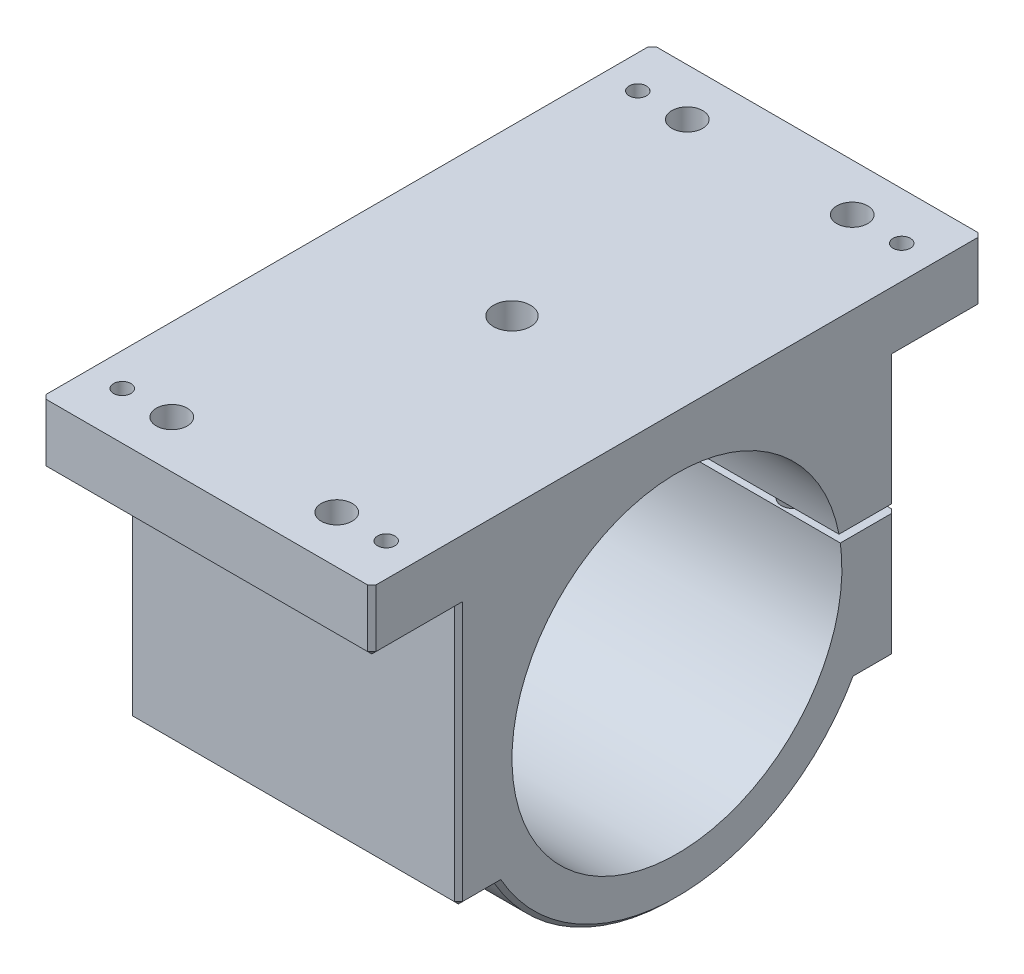
from build123d import *

# Parameters (mm, degrees)
SKETCH1_R           = 40
BOSS_EXTRUDE1_DEPTH = 40
SKETCH2_W           = 80
SKETCH2_H           = 2
CUT_EXTRUDE1_DEPTH  = 19
CUT_EXTRUDE2_START  = -3
SKETCH3_R           = 5.5
CUT_EXTRUDE2_DEPTH  = 118.717043198
SKETCH4_R           = 3
CUT_EXTRUDE3_DEPTH  = 64.5
LPATTERN1_COUNT     = 3
LPATTERN1_PITCH     = 25
SKETCH5_R           = 4.5
SKETCH5_R_2         = 2.1
SKETCH5_R_3         = 3.75
CUT_EXTRUDE4_DEPTH  = 24.5
CHAMFER1_SIZE       = 1


with BuildPart() as part:
    # Sketch1 → Boss-Extrude1 (new, symmetric)
    with BuildSketch(Plane(origin=(0, 0, 0), x_dir=(0, 0, -1), z_dir=(1, 0, 0))):
        with BuildLine():
            Line((-53, -25), (-43.301270189, -25))
            ThreePointArc((-43.301270189, -25), (0, -50), (43.301270189, -25))
            Line((43.301270189, -25), (53, -25))
            Line((53, -25), (53, 38))
            Line((53, 38), (74, 38))
            Line((74, 38), (74, 53))
            Line((74, 53), (-74, 53))
            Line((-74, 53), (-74, 38))
            Line((-74, 38), (-53, 38))
            Line((-53, 38), (-53, -25))
        make_face()
        Circle(SKETCH1_R, mode=Mode.SUBTRACT)
    extrude(amount=BOSS_EXTRUDE1_DEPTH, both=True)

    # Sketch2 → Cut-Extrude1 (cut)
    with BuildSketch(Plane(origin=(0, 0, -53), x_dir=(-1, 0, 0), z_dir=(0, 0, -1))):
        with Locations((0, 6.5)):
            Rectangle(SKETCH2_W, SKETCH2_H)
    extrude(amount=-CUT_EXTRUDE1_DEPTH, mode=Mode.SUBTRACT)

    # Sketch3 → Cut-Extrude2 (cut, through all)
    with BuildSketch(Plane.XZ.offset(25).offset(CUT_EXTRUDE2_START)):
        with Locations(Location((25.000000054, -43.3, 0), (0, 0, 180.013232088))):
            Circle(SKETCH3_R)
    cut_extrude2 = extrude(amount=CUT_EXTRUDE2_DEPTH, mode=Mode.SUBTRACT)

    # Sketch4 → Cut-Extrude3 (cut)
    with BuildSketch(Plane.XZ.offset(22)):
        with Locations(Location((25.000000054, -43.3, 0), (0, 0, 270))):
            Circle(SKETCH4_R)
    cut_extrude3 = extrude(amount=-CUT_EXTRUDE3_DEPTH, mode=Mode.SUBTRACT)

    # LPattern1: Cut-Extrude2, Cut-Extrude3 ×3
    with Locations(*[(-i * LPATTERN1_PITCH, 0, 0) for i in range(1, LPATTERN1_COUNT)]):
        add(cut_extrude2, mode=Mode.SUBTRACT)
        add(cut_extrude3, mode=Mode.SUBTRACT)

    # Sketch5 → Cut-Extrude4 (cut)
    with BuildSketch(Plane(origin=(0, 53, 0), x_dir=(1, 0, 0), z_dir=(0, 1, 0))):
        with Locations(Location((0, 0, 0), (0, 0, 270))):
            Circle(SKETCH5_R)
        with Locations(Location((-32, 62.5, 0), (0, 0, 270))):
            Circle(SKETCH5_R_2)
        with Locations(Location((-20, 62.5, 0), (0, 0, 270))):
            Circle(SKETCH5_R_3)
        with Locations(Location((32, 62.5, 0), (0, 0, 270))):
            Circle(SKETCH5_R_2)
        with Locations(Location((20, 62.5, 0), (0, 0, 270))):
            Circle(SKETCH5_R_3)
        with Locations(Location((32, -62.5, 0), (0, 0, 270))):
            Circle(SKETCH5_R_2)
        with Locations(Location((20, -62.5, 0), (0, 0, 270))):
            Circle(SKETCH5_R_3)
        with Locations(Location((-20, -62.5, 0), (0, 0, 270))):
            Circle(SKETCH5_R_3)
        with Locations(Location((-32, -62.5, 0), (0, 0, 270))):
            Circle(SKETCH5_R_2)
    extrude(amount=-CUT_EXTRUDE4_DEPTH, mode=Mode.SUBTRACT)

    # Chamfer1
    chamfer1_edges = [part.edges().sort_by_distance(p)[0] for p in [
        (40, -50, 0),
        (-40, 45.5, -74),
        (-40, 38, -63.5),
        (-40, -9.75, -53),
        (-40, -25, -48.150635095),
        (-40, -50, 0),
        (-40, -25, 48.150635095),
        (-40, 6.5, 53),
        (40, -25, -48.150635095),
        (40, -9.75, -53),
        (0, 38, 74),
        (0, 38, -74),
        (0, -25, -53),
        (0, -25, 53),
        (40, 38, -63.5),
        (40, 45.5, -74),
        (40, 45.5, 74),
        (40, 38, 63.5),
        (-40, 22.75, -53),
        (40, 22.75, -53),
        (40, 6.5, 53),
        (40, -25, 48.150635095),
        (-40, 38, 63.5),
        (-40, 45.5, 74),
    ]]
    chamfer(chamfer1_edges, length=CHAMFER1_SIZE)


solid = part.part
